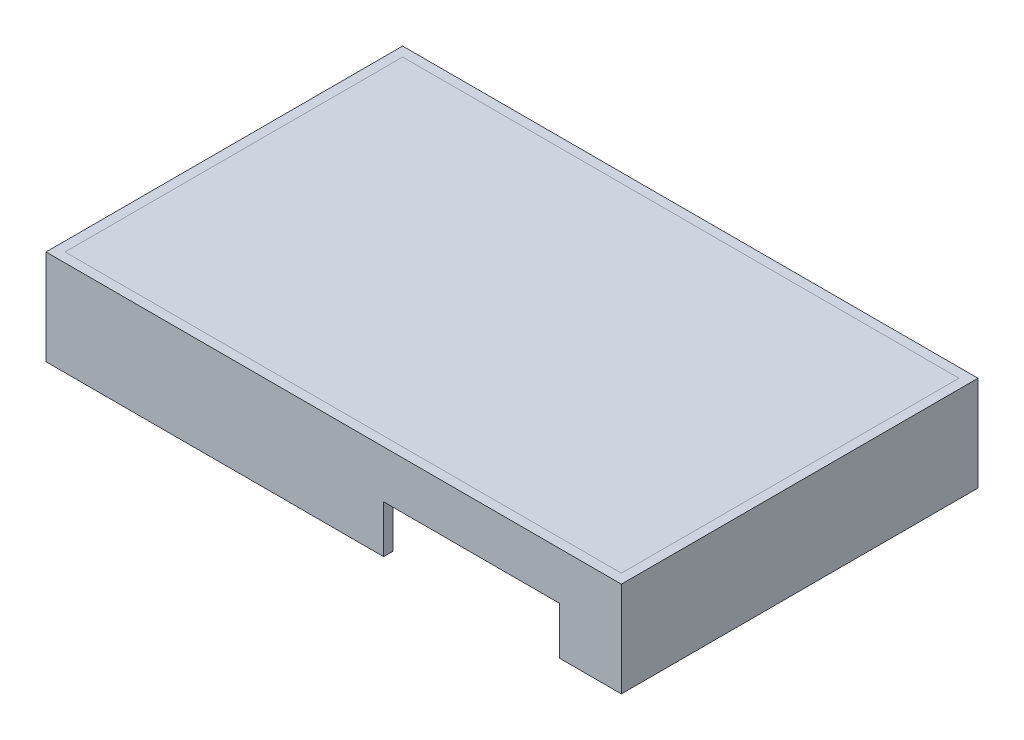
from build123d import *

# Parameters (mm, degrees)
SKETCH1_W                      = 117
SKETCH1_H                      = 71
TOPSHIELD_DEPTH                = 1.5875
SKETCH4_W                      = 121
SKETCH4_H                      = 75
SKETCH4_W_2                    = 117
SKETCH4_H_2                    = 71
WALLS_DEPTH                    = 20
SKETCH5_W                      = 10
SKETCH5_H                      = 10
MOUNTS_DEPTH                   = 3
SKETCH3_W                      = 1.1303
SKETCH3_H                      = 20
F_4_40_TAPPED_HOLE1_AT_2_COUNT = 2
F_4_40_TAPPED_HOLE1_AT_2_PITCH = 107
F_4_40_TAPPED_HOLE1_AT_3_COUNT = 2
F_4_40_TAPPED_HOLE1_AT_3_PITCH = 123.166553902
F_4_40_TAPPED_HOLE1_AT_4_COUNT = 2
F_4_40_TAPPED_HOLE1_AT_4_PITCH = 61
POWERANDMOTOR_START            = -12
SKETCH6_W                      = 15
SKETCH6_H                      = 12
SKETCH6_W_2                    = 14
SKETCH6_H_2                    = 9.287923088
POWERANDMOTOR_DEPTH            = 12
SKETCH7_W                      = 37
SKETCH7_H                      = 10
CONTROLS_DEPTH                 = 2


with BuildPart() as part:
    # Sketch1 → TopShield (new body)
    with BuildSketch(Plane(origin=(0, 0, 0), x_dir=(1, 0, 0), z_dir=(0, 1, 0))):
        Rectangle(SKETCH1_W, SKETCH1_H)
    extrude(amount=TOPSHIELD_DEPTH)


with BuildPart() as body_2:
    # Sketch4 → Walls (new body)
    with BuildSketch(Plane(origin=(0, 1.5875, 0), x_dir=(1, 0, 0), z_dir=(0, 1, 0))):
        Rectangle(SKETCH4_W, SKETCH4_H)
        Rectangle(SKETCH4_W_2, SKETCH4_H_2, mode=Mode.SUBTRACT)
    extrude(amount=-WALLS_DEPTH)

    # Sketch5 → Mounts (add)
    with BuildSketch(Plane.XZ.offset(18.4125)):
        with Locations((-53.5, 30.5)):
            Rectangle(SKETCH5_W, SKETCH5_H)
        with Locations((53.5, 30.5)):
            Rectangle(SKETCH5_W, SKETCH5_H)
        with Locations((53.5, -30.5)):
            Rectangle(SKETCH5_W, SKETCH5_H)
        with Locations((-53.5, -30.5)):
            Rectangle(SKETCH5_W, SKETCH5_H)
    extrude(amount=-MOUNTS_DEPTH)

    # Sketch3 → #4-40 Tapped Hole1 (revolve, cut)
    with BuildSketch(Plane(origin=(-53.5, -18.4125, -30.5), x_dir=(0, 0, -1), z_dir=(1, 0, 0))):
        with Locations((0.56515, 10)):
            Rectangle(SKETCH3_W, SKETCH3_H)
    f_4_40_tapped_hole1 = revolve(axis=Axis((-53.5, -24.7625, -30.5), (0, 1, 0)), mode=Mode.SUBTRACT)

    # #4-40 Tapped Hole1 at 2: #4-40 Tapped Hole1 ×2
    with Locations(*[(i * F_4_40_TAPPED_HOLE1_AT_2_PITCH, 0, 0) for i in range(1, F_4_40_TAPPED_HOLE1_AT_2_COUNT)]):
        add(f_4_40_tapped_hole1, mode=Mode.SUBTRACT)

    # #4-40 Tapped Hole1 at 3: #4-40 Tapped Hole1 ×2
    with Locations(*[Vector(0.8687423380008604, 0, 0.49526432353320055) * (i * F_4_40_TAPPED_HOLE1_AT_3_PITCH) for i in range(1, F_4_40_TAPPED_HOLE1_AT_3_COUNT)]):
        add(f_4_40_tapped_hole1, mode=Mode.SUBTRACT)

    # #4-40 Tapped Hole1 at 4: #4-40 Tapped Hole1 ×2
    with Locations(*[(0, 0, i * F_4_40_TAPPED_HOLE1_AT_4_PITCH) for i in range(1, F_4_40_TAPPED_HOLE1_AT_4_COUNT)]):
        add(f_4_40_tapped_hole1, mode=Mode.SUBTRACT)

    # Sketch6 → PowerAndMotor (cut)
    with BuildSketch(Plane(origin=(0, 0, -37.5), x_dir=(-1, 0, 0), z_dir=(0, 0, -1)).offset(POWERANDMOTOR_START)):
        with Locations((43, -12.4125)):
            Rectangle(SKETCH6_W, SKETCH6_H)
        with Locations((10.5, -13.768538456)):
            Rectangle(SKETCH6_W_2, SKETCH6_H_2)
    extrude(amount=POWERANDMOTOR_DEPTH, mode=Mode.SUBTRACT)

    # Sketch7 → Controls (cut)
    with BuildSketch(Plane.XY.offset(37.5)):
        with Locations((29, -13.4125)):
            Rectangle(SKETCH7_W, SKETCH7_H)
    extrude(amount=-CONTROLS_DEPTH, mode=Mode.SUBTRACT)


solid = Compound([part.part, body_2.part])
